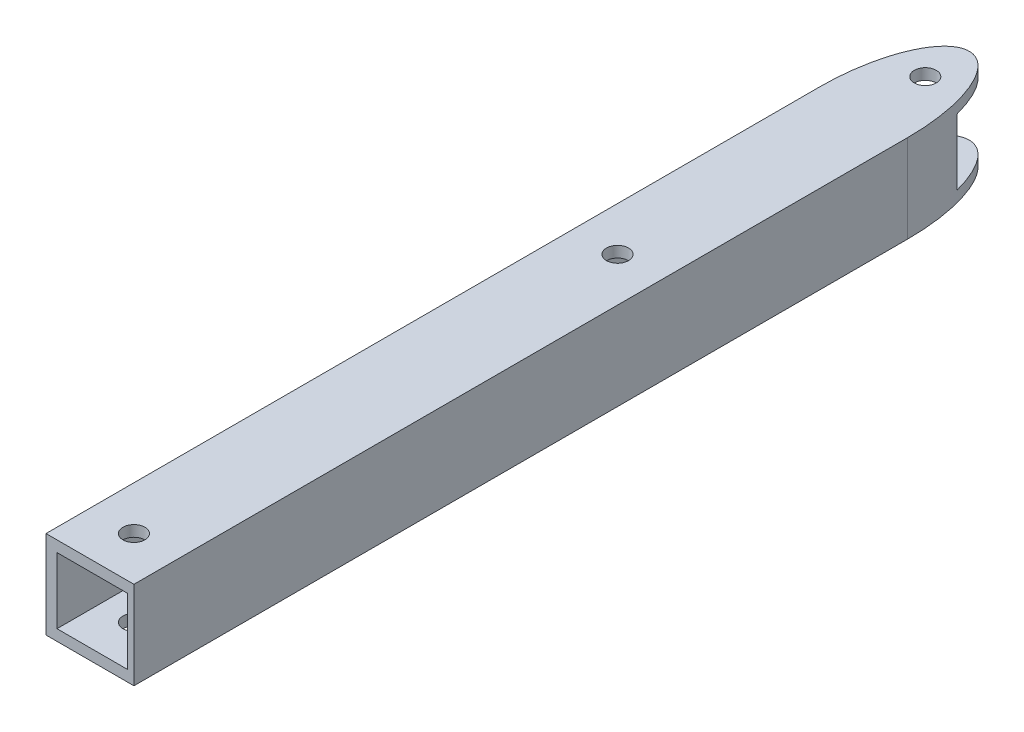
from build123d import *

# Parameters (mm, degrees)
SKETCH1_W           = 25.4
SKETCH1_H           = 25.4
BOSS_EXTRUDE2_DEPTH = 254
SKETCH2_W           = 20.302766191
SKETCH2_H           = 19.05
CUT_EXTRUDE1_DEPTH  = 257.527425434
CUT_EXTRUDE2_DEPTH  = 257.527425434
SKETCH6_R           = 3.175
CUT_EXTRUDE5_DEPTH  = 257.527425553
SKETCH4_R           = 3.175
CUT_EXTRUDE6_DEPTH  = 257.527425553
SKETCH7_R           = 3.175
CUT_EXTRUDE7_DEPTH  = 257.527425553


with BuildPart() as part:
    # Sketch1 → Boss-Extrude2 (new body)
    with BuildSketch(Plane.XY):
        with Locations((12.7, 12.7)):
            Rectangle(SKETCH1_W, SKETCH1_H)
    extrude(amount=BOSS_EXTRUDE2_DEPTH)

    # Sketch2 → Cut-Extrude1 (cut, through all)
    with BuildSketch(Plane(origin=(0, 0, 0), x_dir=(-1, 0, 0), z_dir=(0, 0, -1))):
        with Locations((-13.326383096, 12.7)):
            Rectangle(SKETCH2_W, SKETCH2_H)
    extrude(amount=-CUT_EXTRUDE1_DEPTH, mode=Mode.SUBTRACT)

    # Sketch3 → Cut-Extrude2 (cut, through all)
    with BuildSketch(Plane(origin=(0, 25.4, 0), x_dir=(1, 0, 0), z_dir=(0, 1, 0))):
        with BuildLine():
            add(Edge.make_bspline(
                [(12.7, 0), (0, 0), (0, -30.465860076)],
                knots=[6.283185307, 6.283185307, 6.283185307, 7.853981634, 7.853981634, 7.853981634], degree=2, weights=[1, 0.707106781, 1]))
            Line((12.7, 0), (0, 0))
            Line((0, 0), (0, -30.465860076))
        make_face()
        with BuildLine():
            Line((25.4, 0), (12.7, 0))
            add(Edge.make_bspline(
                [(25.4, -30.465860076), (25.4, 0), (12.7, 0)],
                knots=[4.71238898, 4.71238898, 4.71238898, 6.283185307, 6.283185307, 6.283185307], degree=2, weights=[1, 0.707106781, 1]))
            Line((25.4, -30.465860076), (25.4, 0))
        make_face()
    extrude(amount=-CUT_EXTRUDE2_DEPTH, mode=Mode.SUBTRACT)

    # Sketch6 → Cut-Extrude5 (cut, through all)
    with BuildSketch(Plane(origin=(0, 25.4, 0), x_dir=(1, 0, 0), z_dir=(0, 1, 0))):
        with Locations(Location((12.7, -12.7, 0), (0, 0, 270))):
            Circle(SKETCH6_R)
    extrude(amount=-CUT_EXTRUDE5_DEPTH, mode=Mode.SUBTRACT)

    # Sketch4 → Cut-Extrude6 (cut, through all)
    with BuildSketch(Plane(origin=(0, 25.4, 0), x_dir=(1, 0, 0), z_dir=(0, 1, 0))):
        with Locations(Location((12.7, -101.6, 0), (0, 0, 270))):
            Circle(SKETCH4_R)
    extrude(amount=-CUT_EXTRUDE6_DEPTH, mode=Mode.SUBTRACT)

    # Sketch7 → Cut-Extrude7 (cut, through all)
    with BuildSketch(Plane(origin=(0, 25.4, 0), x_dir=(1, 0, 0), z_dir=(0, 1, 0))):
        with Locations(Location((12.7, -241.3, 0), (0, 0, 270))):
            Circle(SKETCH7_R)
    extrude(amount=-CUT_EXTRUDE7_DEPTH, mode=Mode.SUBTRACT)


solid = part.part
